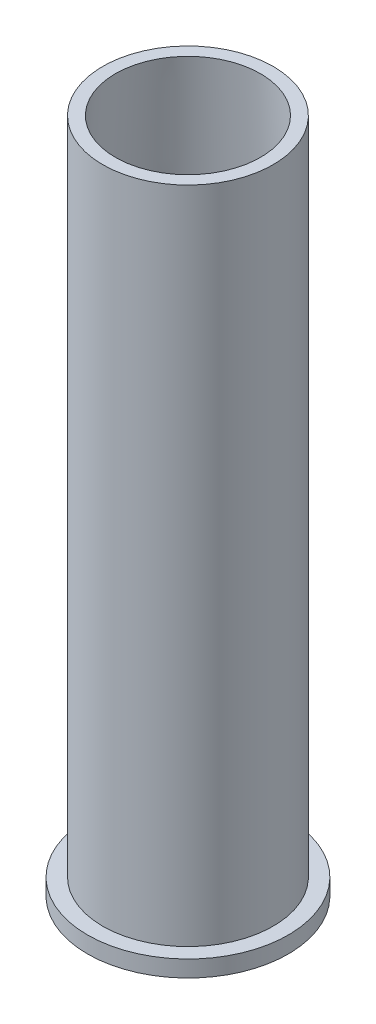
from build123d import *

# Parameters (mm, degrees)
CROQUIS1_R              = 18.2625
SALIENTE_EXTRUIR1_DEPTH = 3
CROQUIS2_R              = 15.5
SALIENTE_EXTRUIR2_DEPTH = 120
CROQUIS3_R              = 14.75
CORTAR_EXTRUIR1_DEPTH   = 102


with BuildPart() as part:
    # Croquis1 → Saliente-Extruir1 (new body)
    with BuildSketch(Plane(origin=(0, 0, 0), x_dir=(1, 0, 0), z_dir=(0, 1, 0))):
        with Locations(Location((0, 0, 0), (0, 0, 270))):
            Circle(CROQUIS1_R)
    extrude(amount=SALIENTE_EXTRUIR1_DEPTH)

    # Croquis2 → Saliente-Extruir2 (add)
    with BuildSketch(Plane(origin=(0, 3, 0), x_dir=(1, 0, 0), z_dir=(0, 1, 0))):
        with Locations(Location((0, 0, 0), (0, 0, 270))):
            Circle(CROQUIS2_R)
    extrude(amount=SALIENTE_EXTRUIR2_DEPTH)

    # Croquis3 → Cortar-Extruir1 (cut)
    with BuildSketch(Plane.XZ):
        with Locations(Location((0, 0, 0), (0, 0, 270))):
            Circle(CROQUIS3_R)
    extrude(amount=-CORTAR_EXTRUIR1_DEPTH, mode=Mode.SUBTRACT)

    # Croquis4 → Cortar-Revolución3 (revolve, cut)
    with BuildSketch(Plane.XY):
        Polygon((0, 102), (-14.75, 102), (-13.2, 123), (0, 123), align=None)
    revolve(axis=Axis((0, 123, 0), (0, -1, 0)), mode=Mode.SUBTRACT)


solid = part.part
